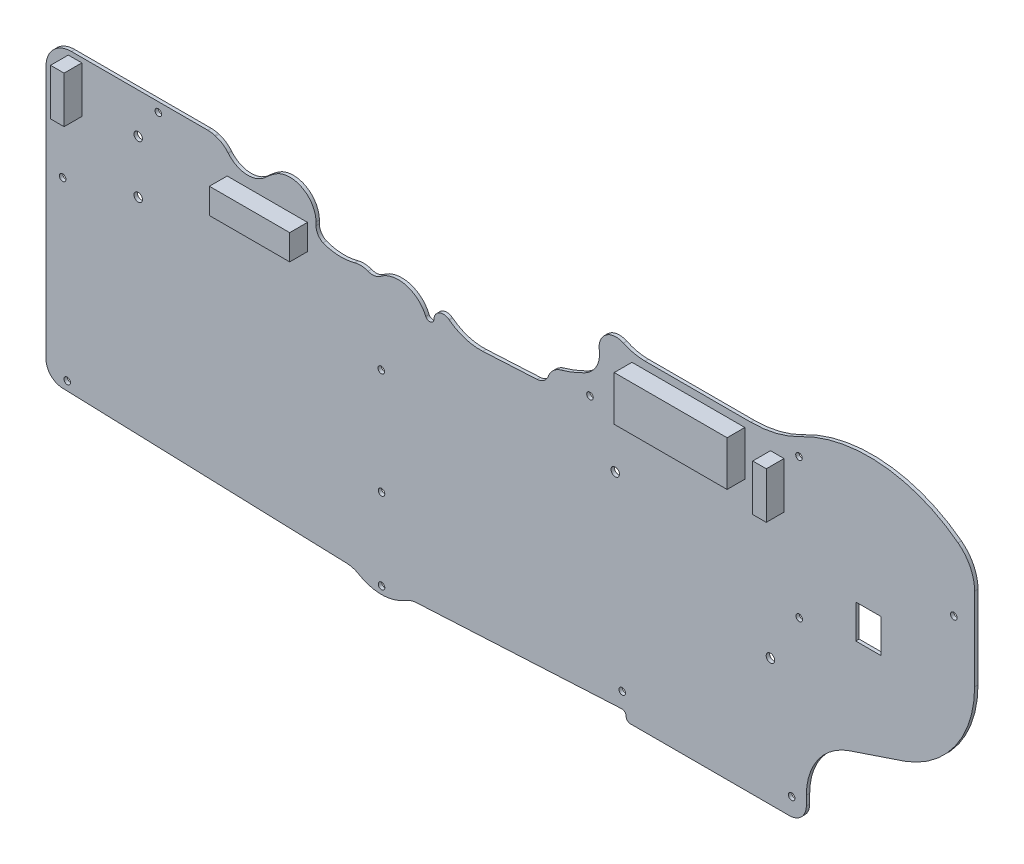
from build123d import *

# Parameters (mm, degrees)
ESTRUSIONE_ESTRUSIONE2_DEPTH = 1.6
SCHIZZO2_R                   = 2
TAGLIO_ESTRUSIONE1_DEPTH     = 10
SCHIZZO8_W                   = 53.4
SCHIZZO8_H                   = 21.2
SCHIZZO8_W_2                 = 6.4
SCHIZZO8_H_2                 = 21.96
SCHIZZO8_W_3                 = 38
SCHIZZO8_H_3                 = 12
ESTRUSIONE_ESTRUSIONE3_DEPTH = 10
FORO_3_1_3_1_1_D             = 3.1
SCHIZZO12_W                  = 12
SCHIZZO12_H                  = 16
TAGLIO_ESTRUSIONE2_DEPTH     = 10


with BuildPart() as part:
    # bordo2 → Estrusione-Estrusione2 (new body)
    with BuildSketch(Plane.XY):
        with BuildLine():
            Line((-158.754433684, 116.187089821), (-158.754433684, -3.865947122))
            ThreePointArc((-158.754433684, -3.865947122), (-156.505538032, -9.426954116), (-151.023233988, -11.861429997))
            Line((-151.023233988, -11.861429997), (-16.437702381, -16.386063763))
            ThreePointArc((-16.437702381, -16.386063763), (-13.471762347, -16.861957987), (-10.716938169, -18.059546957))
            ThreePointArc((-10.716938169, -18.059546957), (0.214142299, -20.99890814), (11.083005754, -17.837235869))
            ThreePointArc((11.083005754, -17.837235869), (13.822228864, -16.580762318), (16.788120425, -16.046387663))
            Line((16.788120425, -16.046387663), (113.64611863, -10.970275071))
            ThreePointArc((113.64611863, -10.970275071), (115.127499694, -11.516785399), (115.750790543, -12.967534141))
            Line((115.750790543, -12.967534141), (115.750790543, -13.091597346))
            ThreePointArc((115.750790543, -13.091597346), (116.336576981, -14.505810909), (117.750790543, -15.091597346))
            Line((117.750790543, -15.091597346), (193, -15.091597346))
            ThreePointArc((193, -15.091597346), (198.656854249, -12.748451596), (201, -7.091597346))
            Line((201, -7.091597346), (201, -2.727936118))
            ThreePointArc((201, -2.727936118), (206.640455622, 14.782420751), (221.440839847, 25.708351564))
            Line((221.440839847, 25.708351564), (247.399963271, 34.43478664))
            ThreePointArc((247.399963271, 34.43478664), (271.481734612, 52.716367083), (280.623213556, 81.536173764))
            Line((280.623213556, 81.536173764), (280.623213556, 120.714334058))
            ThreePointArc((280.623213556, 120.714334058), (278.556224626, 129.569113216), (272.782502161, 136.593619325))
            ThreePointArc((272.782502161, 136.593619325), (236.38547949, 150.641341579), (198.16455661, 142.815562768))
            ThreePointArc((198.16455661, 142.815562768), (186.818545747, 138.475666611), (174.760806771, 137))
            Line((174.760806771, 137), (124.67436916, 137))
            ThreePointArc((124.67436916, 137), (119.429676247, 137.580068398), (114.43850672, 139.292233645))
            ThreePointArc((114.43850672, 139.292233645), (106.197691209, 138.475942424), (103.023486693, 130.82729566))
            ThreePointArc((103.023486693, 130.82729566), (102.639348768, 125.614781735), (100.075807145, 121.059991103))
            ThreePointArc((100.075807145, 121.059991103), (99.881158934, 120.843862569), (99.686086367, 120.628116972))
            ThreePointArc((99.686086367, 120.628116972), (98.127896826, 119.187643435), (96.340342687, 118.044153663))
            ThreePointArc((96.340342687, 118.044153663), (90.73314925, 115.468824104), (84.896818522, 113.466279669))
            ThreePointArc((84.896818522, 113.466279669), (81.223809571, 111.391901357), (78.878619087, 107.885603918))
            ThreePointArc((78.878619087, 107.885603918), (76.807046099, 105.140996793), (73.568687614, 103.984572456))
            Line((73.568687614, 103.984572456), (47.908191181, 102.639762823))
            ThreePointArc((47.908191181, 102.639762823), (39.500299817, 103.697237213), (31.984038936, 107.610894282))
            ThreePointArc((31.984038936, 107.610894282), (27.325075003, 108.10748534), (24.779841609, 104.173742266))
            ThreePointArc((24.779841609, 104.173742266), (23.153545862, 102.254723235), (20.936931048, 103.443878677))
            ThreePointArc((20.936931048, 103.443878677), (11.600258518, 111.566065701), (-0.535174134, 109.142297901))
            ThreePointArc((-0.535174134, 109.142297901), (-3.341686704, 107.964824618), (-6.364881252, 108.315895646))
            ThreePointArc((-6.364881252, 108.315895646), (-9.502789582, 108.987631441), (-12.691899138, 108.630871146))
            ThreePointArc((-12.691899138, 108.630871146), (-20.24385632, 107.770369186), (-27.692371148, 109.284353259))
            ThreePointArc((-27.692371148, 109.284353259), (-30.106556798, 111.496306745), (-30.999967426, 114.646361987))
            Line((-30.999967426, 114.646361987), (-30.999963226, 116.187057109))
            ThreePointArc((-30.999963226, 116.187057109), (-36.980182385, 126.620513133), (-49, 127))
            ThreePointArc((-49, 127), (-52.072194014, 124.94805369), (-54.892871514, 122.562128679))
            ThreePointArc((-54.892871514, 122.562128679), (-63.960512309, 119.217688785), (-72.552773096, 123.642668149))
            ThreePointArc((-72.552773096, 123.642668149), (-75.205541561, 126.063997519), (-78.456042527, 127.591826018))
            ThreePointArc((-78.456042527, 127.591826018), (-78.680837, 127.65808008), (-78.905966578, 127.72318637))
            ThreePointArc((-78.905966578, 127.72318637), (-80.541919682, 128.070548042), (-82.210278367, 128.187089821))
            Line((-82.210278367, 128.187089821), (-146.754433684, 128.187089821))
            ThreePointArc((-146.754433684, 128.187089821), (-155.239715059, 124.672371195), (-158.754433684, 116.187089821))
        make_face()
    extrude(amount=ESTRUSIONE_ESTRUSIONE2_DEPTH)

    # Schizzo2 → Taglio-Estrusione1 (cut)
    with BuildSketch(Plane.XY.offset(1.6)):
        with Locations((110.578126436, 84.562458849)):
            Circle(SCHIZZO2_R)
        with Locations((184, 45)):
            Circle(SCHIZZO2_R)
        with Locations((-115.131933684, 84.277035982)):
            Circle(SCHIZZO2_R)
        with Locations((-115.131933684, 109.187589821)):
            Circle(SCHIZZO2_R)
    extrude(amount=-TAGLIO_ESTRUSIONE1_DEPTH, mode=Mode.SUBTRACT)

    # Schizzo8 → Estrusione-Estrusione3 (add)
    with BuildSketch(Plane.XY):
        with Locations((145.200028088, 122.829953321)):
            Rectangle(SCHIZZO8_W, SCHIZZO8_H)
        with Locations((-144.999971912, 114.999953321)):
            Rectangle(SCHIZZO8_W_2, SCHIZZO8_H_2)
        with Locations((187.245628088, 118.999953321)):
            Rectangle(SCHIZZO8_W_2, SCHIZZO8_H_2)
        with Locations((-54.041371912, 107.999953321)):
            Rectangle(SCHIZZO8_W_3, SCHIZZO8_H_3)
    extrude(amount=ESTRUSIONE_ESTRUSIONE3_DEPTH)

    # Foro Ø3.1 (3.1)-1 (through all)
    with Locations(Plane.XY.offset(1.6)):
        with Locations((-105.606713702, 123.757761503), (-150.881154472, 74.423504607), (-148.705373273, -7.765150729), (0, -17.434580106), (0, 20.969513485), (-0.120683654, 70.999897433), (98.633890728, 109.736207798), (197.634129984, 68.336031239), (194.042729825, -6.748739049), (113.891576714, -3.672362968), (270.790603772, 105.604483849), (197.521931264, 134.344122063)):
            Hole(FORO_3_1_3_1_1_D / 2)

    # Schizzo12 → Taglio-Estrusione2 (cut)
    with BuildSketch(Plane.XY.offset(1.6)):
        with Locations((230.408257616, 80.165324897)):
            Rectangle(SCHIZZO12_W, SCHIZZO12_H)
    extrude(amount=-TAGLIO_ESTRUSIONE2_DEPTH, mode=Mode.SUBTRACT)


solid = part.part
